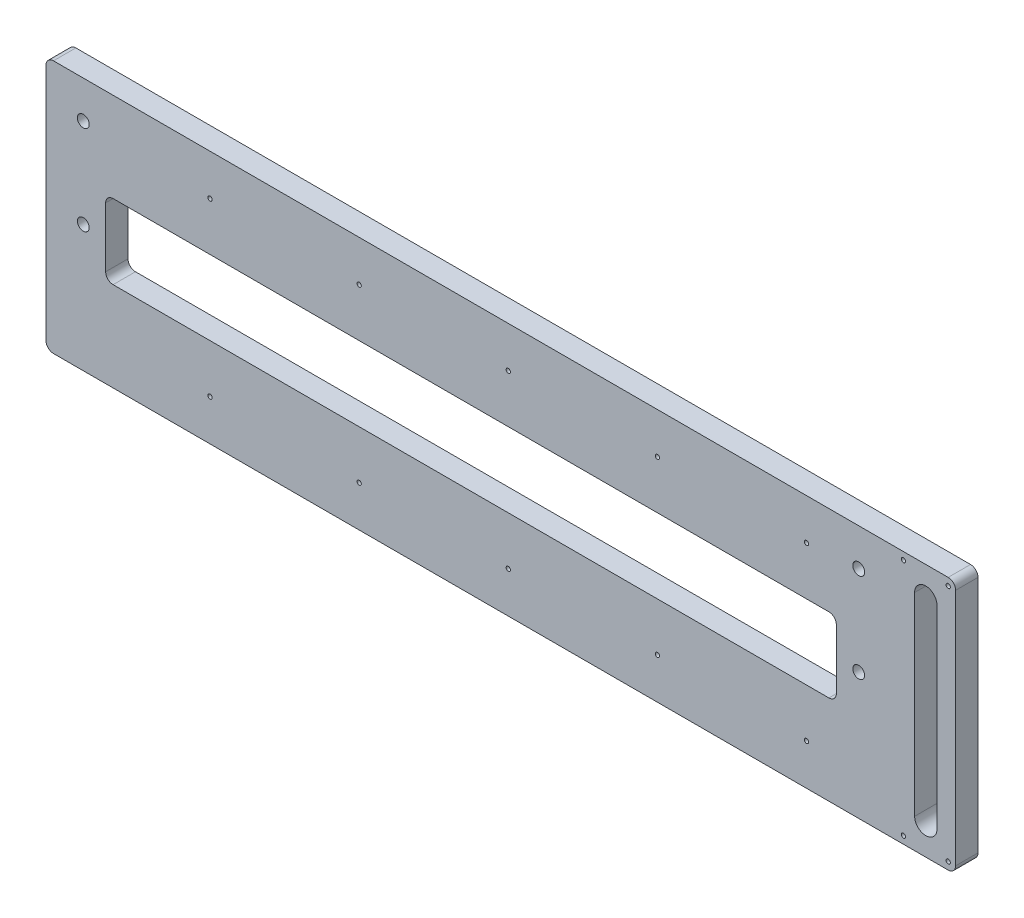
from build123d import *

# Parameters (mm, degrees)
SKETCH2_W                   = 723.9
SKETCH2_H                   = 215.9
BOSS_EXTRUDE1_DEPTH         = 19.05
CUT_EXTRUDE3_DEPTH          = 409.675659906
F_27_0_144_DIAMETER_HOLE1_D = 3.6576
F_3_8_CLEARANCE_HOLE1_D     = 10.0838
SKETCH22_W                  = 19.05
SKETCH22_H                  = 215.9
BOSS_EXTRUDE2_DEPTH         = 50.8
FILLET1_R                   = 6.35
F_6_CLEARANCE_HOLE1_D       = 3.6576
CUT_EXTRUDE4_DEPTH          = 76.2


with BuildPart() as part:
    # Sketch2 → Boss-Extrude1 (new body)
    with BuildSketch(Plane.XY):
        with Locations((-31.75, 0)):
            Rectangle(SKETCH2_W, SKETCH2_H)
    extrude(amount=BOSS_EXTRUDE1_DEPTH)

    # Sketch13 → Cut-Extrude3 (cut, through all)
    with BuildSketch(Plane.XY.offset(19.05)):
        with BuildLine():
            Line((-336.55, -31.75), (273.05, -31.75))
            ThreePointArc((273.05, -31.75), (277.540128061, -29.890128061), (279.4, -25.4))
            Line((279.4, -25.4), (279.4, 25.4))
            ThreePointArc((279.4, 25.4), (277.540128061, 29.890128061), (273.05, 31.75))
            Line((273.05, 31.75), (-336.55, 31.75))
            ThreePointArc((-336.55, 31.75), (-341.040128061, 29.890128061), (-342.9, 25.4))
            Line((-342.9, 25.4), (-342.9, -25.4))
            ThreePointArc((-342.9, -25.4), (-341.040128061, -29.890128061), (-336.55, -31.75))
        make_face()
    extrude(amount=-CUT_EXTRUDE3_DEPTH, mode=Mode.SUBTRACT)

    # #27 (0.144) Diameter Hole1 (through all)
    with Locations(Plane(origin=(0, 0, 0), x_dir=(-1, 0, 0), z_dir=(0, 0, -1))):
        with Locations((0, 0), (-254, 73.025), (-127, 73.025), (0, 73.025), (127, 73.025), (254, 73.025), (-127, -73.025), (0, -73.025), (127, -73.025), (254, -73.025), (-254, -73.025)):
            Hole(F_27_0_144_DIAMETER_HOLE1_D / 2)

    # 3/8 Clearance Hole1 (through all)
    with Locations(Plane(origin=(0, 0, 0), x_dir=(-1, 0, 0), z_dir=(0, 0, -1))):
        with Locations((-298.45, 76.2), (361.95, 76.2), (361.95, 0), (-298.45, 0)):
            Hole(F_3_8_CLEARANCE_HOLE1_D / 2)

    # Sketch22 → Boss-Extrude2 (add)
    with BuildSketch(Plane(origin=(330.2, 0, 0), x_dir=(0, 0, -1), z_dir=(1, 0, 0))):
        with Locations((-9.525, 0)):
            Rectangle(SKETCH22_W, SKETCH22_H)
    extrude(amount=BOSS_EXTRUDE2_DEPTH)

    # Fillet1
    fillet1_edges = [part.edges().sort_by_distance(p)[0] for p in [
        (381, -107.95, 9.525),
        (381, 107.95, 9.525),
        (-393.7, 107.95, 9.525),
        (-393.7, -107.95, 9.525),
    ]]
    fillet(fillet1_edges, radius=FILLET1_R)

    # #6 Clearance Hole1 (through all)
    with Locations(Plane.XY.offset(19.05)):
        with Locations((336.55, -101.6), (355.6, 0), (336.55, 101.6), (374.65, -101.6), (374.65, 101.6)):
            Hole(F_6_CLEARANCE_HOLE1_D / 2)

    # Sketch25 → Cut-Extrude4 (cut)
    with BuildSketch(Plane.XY.offset(19.05)):
        with BuildLine():
            Line((346.075, -82.55), (346.075, 82.55))
            ThreePointArc((346.075, 82.55), (355.6, 92.075), (365.125, 82.55))
            Line((365.125, 82.55), (365.125, -82.55))
            ThreePointArc((365.125, -82.55), (355.6, -92.075), (346.075, -82.55))
        make_face()
    extrude(amount=-CUT_EXTRUDE4_DEPTH, mode=Mode.SUBTRACT)


solid = part.part
